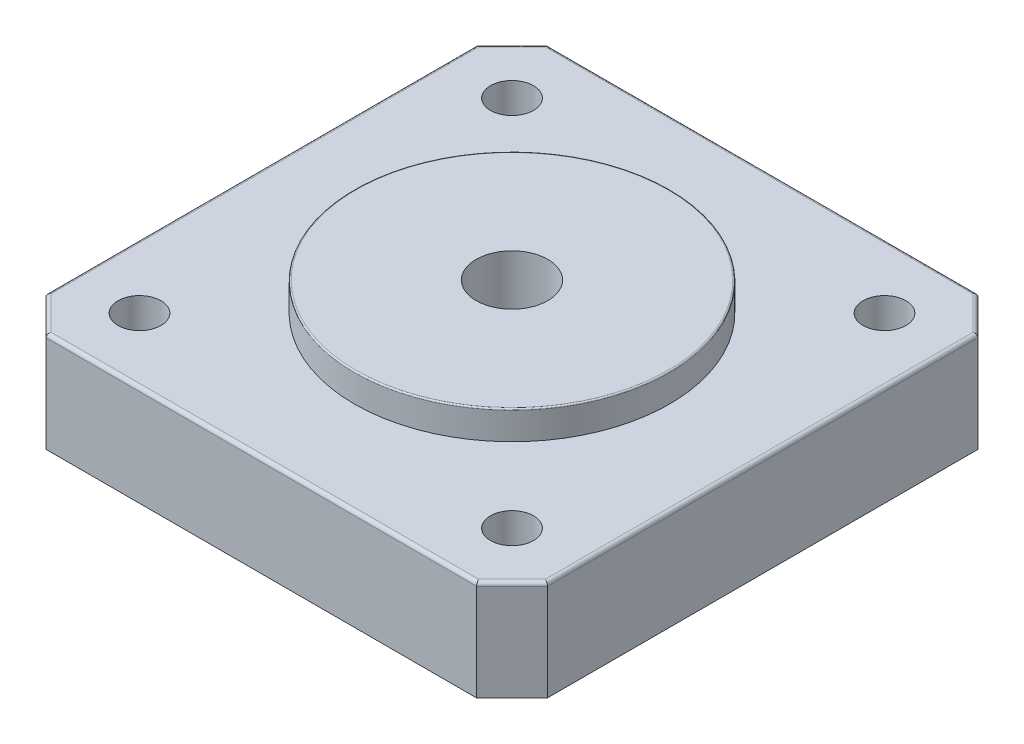
from build123d import *

# Parameters (mm, degrees)
SALIENTE_EXTRUIR1_DEPTH = 7
CROQUIS2_R              = 2.5
CORTAR_EXTRUIR1_DEPTH   = 50.989999
CROQUIS3_R              = 1.5
CORTAR_EXTRUIR2_DEPTH   = 50.989999
SALIENTE_EXTRUIR2_START = 2
CROQUIS4_R              = 11
CROQUIS4_R_2            = 2.5
SALIENTE_EXTRUIR2_DEPTH = 2
REDONDEO1_R             = 0.1
REDONDEO3_R             = 0.25


with BuildPart() as part:
    # Croquis1 → Saliente-Extruir1 (new body)
    with BuildSketch(Plane(origin=(0, 0, 0), x_dir=(1, 0, 0), z_dir=(0, 1, 0))):
        Polygon((0, 32.526911935), (2.473088065, 35), (32.526911935, 35), (35, 32.526911935), (35, 2.473088065), (32.526911935, 0), (2.473088065, 0), (0, 2.473088065), align=None)
    extrude(amount=SALIENTE_EXTRUIR1_DEPTH)

    # Croquis2 → Cortar-Extruir1 (cut, through all)
    with BuildSketch(Plane(origin=(0, 7, 0), x_dir=(1, 0, 0), z_dir=(0, 1, 0))):
        with Locations(Location((17.5, 17.5, 0), (0, 0, 270))):
            Circle(CROQUIS2_R)
    extrude(amount=-CORTAR_EXTRUIR1_DEPTH, mode=Mode.SUBTRACT)

    # Croquis3 → Cortar-Extruir2 (cut, through all)
    with BuildSketch(Plane(origin=(0, 7, 0), x_dir=(1, 0, 0), z_dir=(0, 1, 0))):
        with Locations(Location((4.5, 30.5, 0), (0, 0, 270))):
            Circle(CROQUIS3_R)
        with Locations(Location((30.5, 30.5, 0), (0, 0, 270))):
            Circle(CROQUIS3_R)
        with Locations(Location((30.5, 4.5, 0), (0, 0, 270))):
            Circle(CROQUIS3_R)
        with Locations(Location((4.5, 4.5, 0), (0, 0, 270))):
            Circle(CROQUIS3_R)
    extrude(amount=-CORTAR_EXTRUIR2_DEPTH, mode=Mode.SUBTRACT)

    # Croquis4 → Saliente-Extruir2 (add)
    with BuildSketch(Plane(origin=(0, 7, 0), x_dir=(1, 0, 0), z_dir=(0, 1, 0)).offset(SALIENTE_EXTRUIR2_START)):
        with Locations(Location((17.5, 17.5, 0), (0, 0, 90))):
            Circle(CROQUIS4_R)
        with Locations(Location((17.5, 17.5, 0), (0, 0, 270))):
            Circle(CROQUIS4_R_2, mode=Mode.SUBTRACT)
    extrude(amount=-SALIENTE_EXTRUIR2_DEPTH)

    # Redondeo1
    redondeo1_edges = [part.edges().sort_by_distance(p)[0] for p in [
        (17.5, 9, -6.5),
    ]]
    fillet(redondeo1_edges, radius=REDONDEO1_R)

    # Redondeo3
    redondeo3_edges = [part.edges().sort_by_distance(p)[0] for p in [
        (17.5, 7, 0),
        (33.763455967, 7, -1.236544033),
        (35, 7, -17.5),
        (33.763455967, 7, -33.763455967),
        (17.5, 7, -35),
        (1.236544033, 7, -33.763455967),
        (0, 7, -17.5),
        (1.236544033, 7, -1.236544033),
    ]]
    fillet(redondeo3_edges, radius=REDONDEO3_R)


solid = part.part
